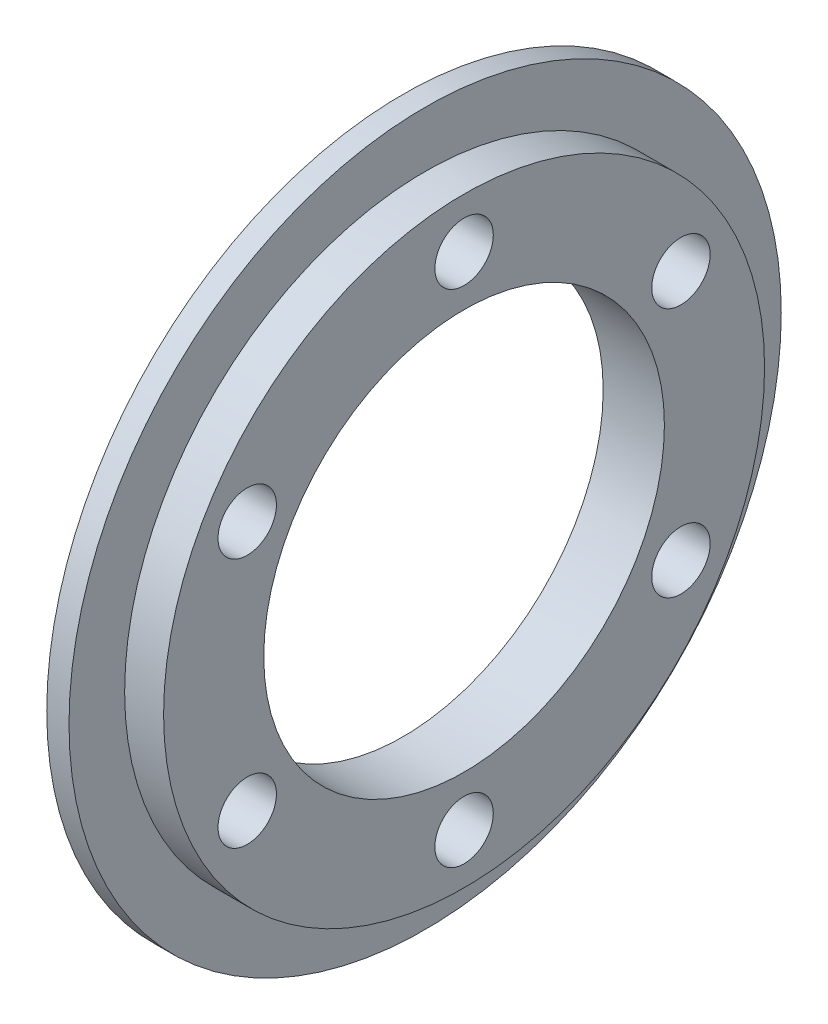
from build123d import *

# Parameters (mm, degrees)
M10_CLEARANCE_HOLE1_D = 10.5


with BuildPart() as part:
    # Sketch1 → Revolve1 (revolve)
    with BuildSketch(Plane(origin=(0, 0, 0), x_dir=(1, 0, 0), z_dir=(0, 1, 0)), mode=Mode.PRIVATE) as revolve1_sk:
        Polygon((0, 54), (0, 36), (11, 36), (11, 54), (4, 54), (4, 64), (0, 64), align=None)
    revolve(revolve1_sk.sketch.rotate(Axis((-0.5, 0, 0), (1, 0, 0)), 180), axis=Axis((-0.5, 0, 0), (1, 0, 0)))

    # M10 Clearance Hole1 (through all)
    with Locations(Plane(origin=(11, 0, 0), x_dir=(0, 0, -1), z_dir=(1, 0, 0))):
        with Locations((-38.97114317, 22.5), (0, 45), (38.97114317, 22.5), (38.97114317, -22.5), (0, -45), (-38.97114317, -22.5)):
            Hole(M10_CLEARANCE_HOLE1_D / 2)


solid = part.part
